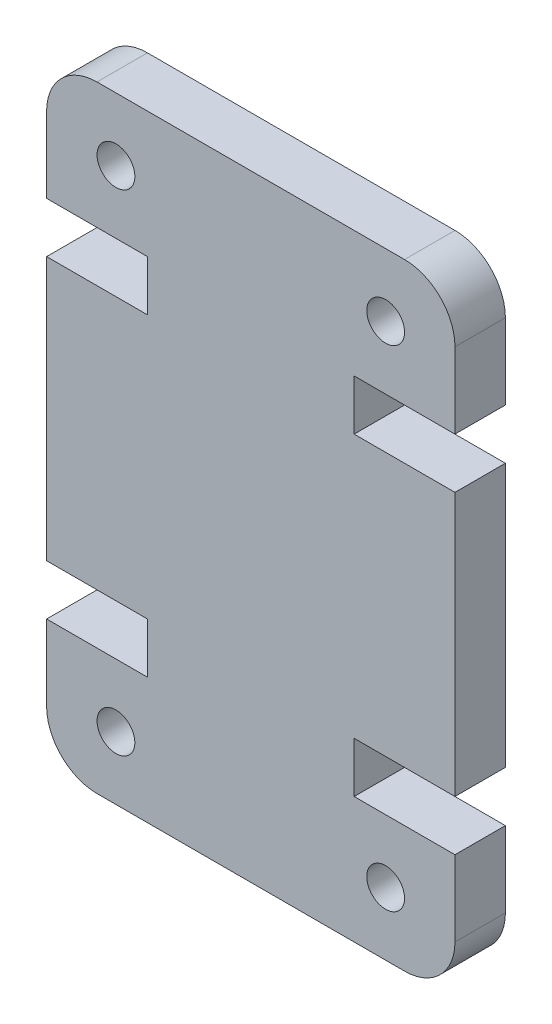
from build123d import *

# Parameters (mm, degrees)
SKETCH1_R           = 0.75
BOSS_EXTRUDE1_DEPTH = 2


with BuildPart() as part:
    # Sketch1 → Boss-Extrude1 (new body)
    with BuildSketch(Plane.XY):
        with BuildLine():
            Line((0, 17.45), (0, 7))
            Line((0, 7), (4, 7))
            Line((4, 7), (4, 5))
            Line((4, 5), (0, 5))
            Line((0, 5), (0, 2))
            ThreePointArc((0, 2), (0.585786438, 0.585786438), (2, 0))
            Line((2, 0), (14.2, 0))
            ThreePointArc((14.2, 0), (15.614213562, 0.585786438), (16.2, 2))
            Line((16.2, 2), (16.2, 5))
            Line((16.2, 5), (12.2, 5))
            Line((12.2, 5), (12.2, 7))
            Line((12.2, 7), (16.2, 7))
            Line((16.2, 7), (16.2, 17.45))
            Line((16.2, 17.45), (12.2, 17.45))
            Line((12.2, 17.45), (12.2, 19.45))
            Line((12.2, 19.45), (16.2, 19.45))
            Line((16.2, 19.45), (16.2, 22.45))
            ThreePointArc((16.2, 22.45), (15.614213562, 23.864213562), (14.2, 24.45))
            Line((14.2, 24.45), (2, 24.45))
            ThreePointArc((2, 24.45), (0.585786438, 23.864213562), (0, 22.45))
            Line((0, 22.45), (0, 19.45))
            Line((0, 19.45), (4, 19.45))
            Line((4, 19.45), (4, 17.45))
            Line((4, 17.45), (0, 17.45))
        make_face()
        with Locations((13.45, 2.5)):
            Circle(SKETCH1_R, mode=Mode.SUBTRACT)
        with Locations((2.75, 2.5)):
            Circle(SKETCH1_R, mode=Mode.SUBTRACT)
        with Locations((13.45, 21.95)):
            Circle(SKETCH1_R, mode=Mode.SUBTRACT)
        with Locations((2.75, 21.95)):
            Circle(SKETCH1_R, mode=Mode.SUBTRACT)
    extrude(amount=BOSS_EXTRUDE1_DEPTH)


solid = part.part
